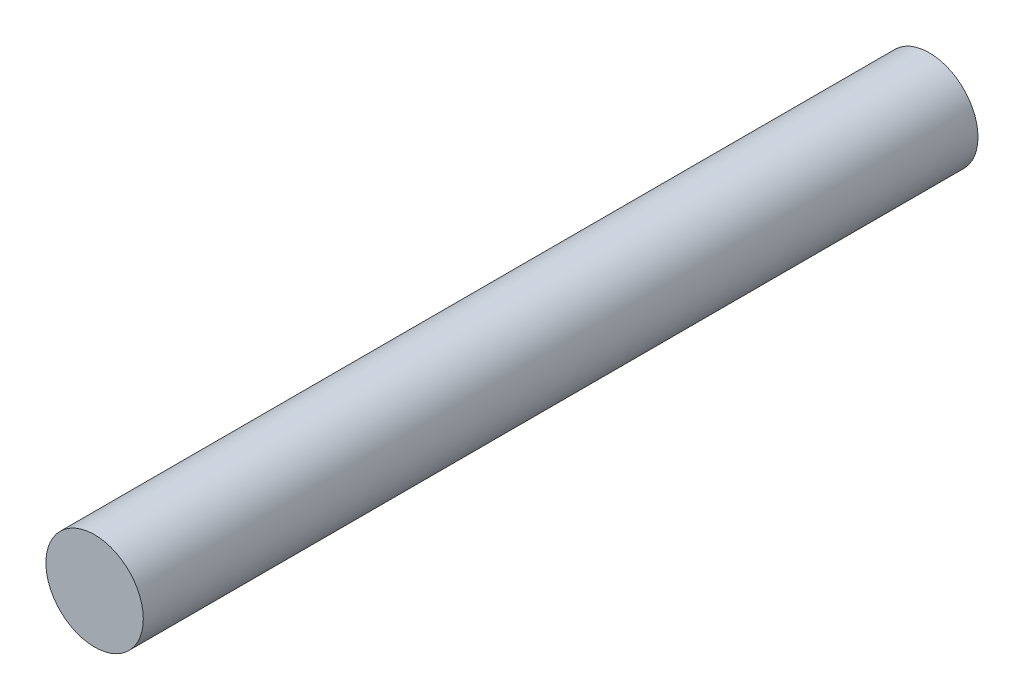
from build123d import *

# Parameters (mm, degrees)
SKETCH_1_R      = 17.5
EXTRUDE_1_DEPTH = 300


with BuildPart() as part:
    # 草图1 → 凸台-拉伸1 (new body)
    with BuildSketch(Plane.XY):
        Circle(SKETCH_1_R)
    extrude(amount=EXTRUDE_1_DEPTH)


solid = part.part
